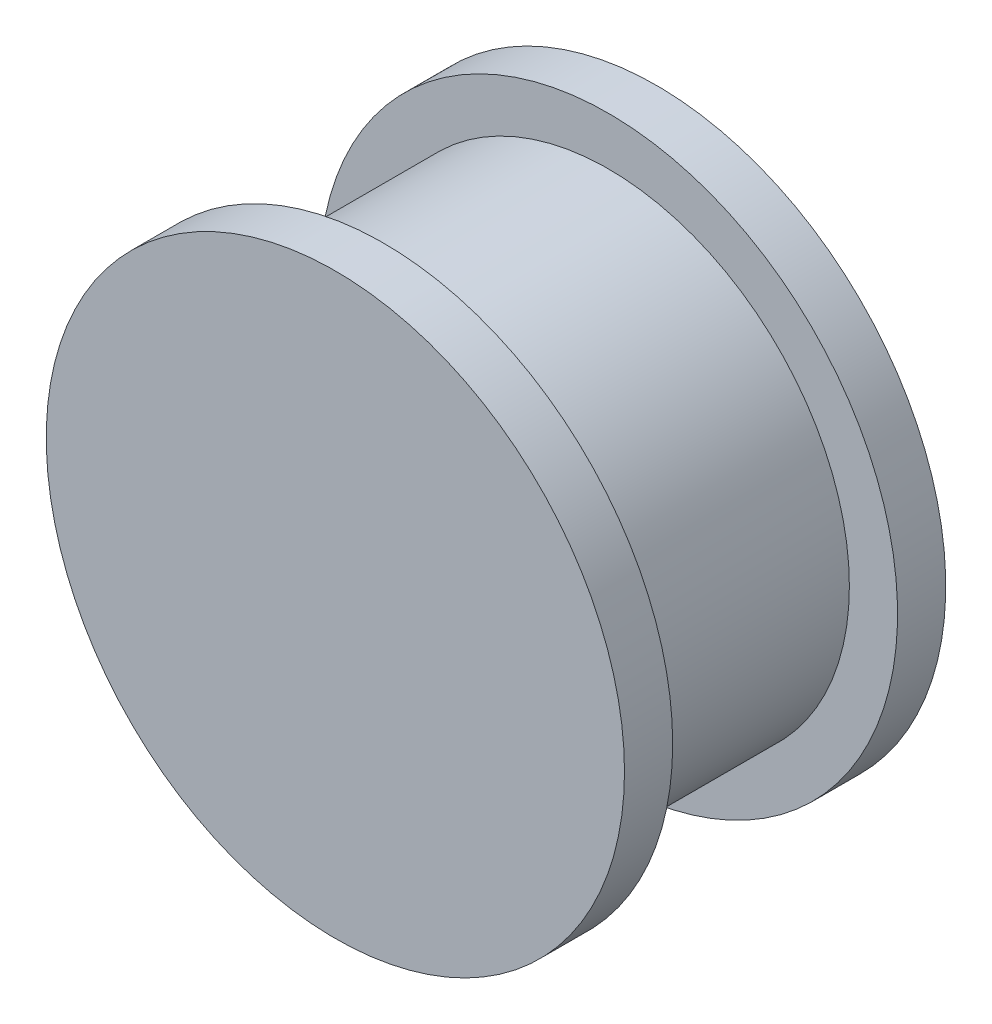
from build123d import *

# Parameters (mm, degrees)
SKETCH1_R           = 7.5
SKETCH1_R_2         = 6.5
BOSS_EXTRUDE2_DEPTH = 7
SKETCH3_R           = 9
BOSS_EXTRUDE3_DEPTH = 1.5
SKETCH4_R           = 9
SKETCH4_R_2         = 6.5
BOSS_EXTRUDE4_DEPTH = 1.5
BOSS_EXTRUDE5_START = 1
SKETCH5_R           = 6.5
BOSS_EXTRUDE5_DEPTH = 1


with BuildPart() as part:
    # Sketch1 → Boss-Extrude2 (new body)
    with BuildSketch(Plane.XY):
        Circle(SKETCH1_R)
        Circle(SKETCH1_R_2, mode=Mode.SUBTRACT)
    extrude(amount=BOSS_EXTRUDE2_DEPTH)

    # Sketch3 → Boss-Extrude3 (add)
    with BuildSketch(Plane.XY.offset(7)):
        Circle(SKETCH3_R)
    extrude(amount=BOSS_EXTRUDE3_DEPTH)

    # Sketch5 → Boss-Extrude5 (add)
    with BuildSketch(Plane(origin=(0, 0, 7), x_dir=(-1, 0, 0), z_dir=(0, 0, -1)).offset(BOSS_EXTRUDE5_START)):
        Circle(SKETCH5_R)
    extrude(amount=-BOSS_EXTRUDE5_DEPTH)


with BuildPart() as body_2:
    # Sketch4 → Boss-Extrude4 (new body)
    with BuildSketch(Plane(origin=(0, 0, 0), x_dir=(-1, 0, 0), z_dir=(0, 0, -1))):
        Circle(SKETCH4_R)
        Circle(SKETCH4_R_2, mode=Mode.SUBTRACT)
    extrude(amount=BOSS_EXTRUDE4_DEPTH)


solid = Compound([part.part, body_2.part])
